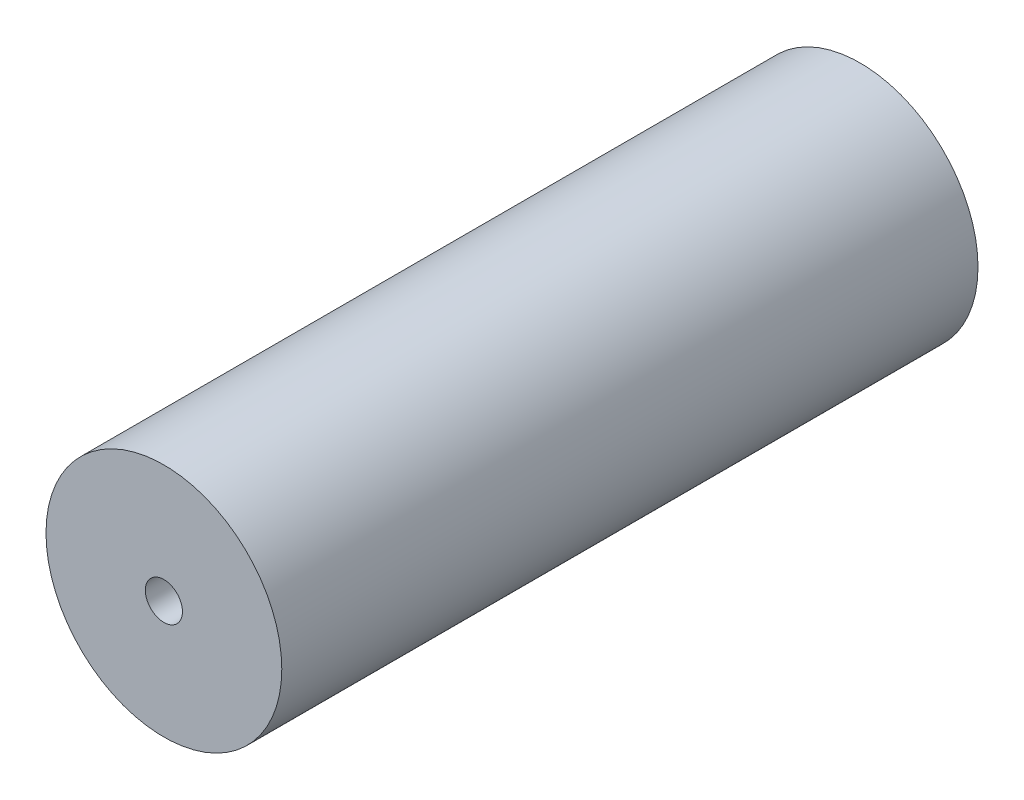
from build123d import *

# Parameters (mm, degrees)
SKETCH1_R           = 25.4
BOSS_EXTRUDE1_DEPTH = 150
SKETCH2_R           = 4
CUT_EXTRUDE1_DEPTH  = 25


with BuildPart() as part:
    # Sketch1 → Boss-Extrude1 (new body)
    with BuildSketch(Plane.XY):
        Circle(SKETCH1_R)
    extrude(amount=BOSS_EXTRUDE1_DEPTH)

    # Sketch2 → Cut-Extrude1 (cut)
    with BuildSketch(Plane.XY.offset(150)):
        Circle(SKETCH2_R)
    extrude(amount=-CUT_EXTRUDE1_DEPTH, mode=Mode.SUBTRACT)


solid = part.part
